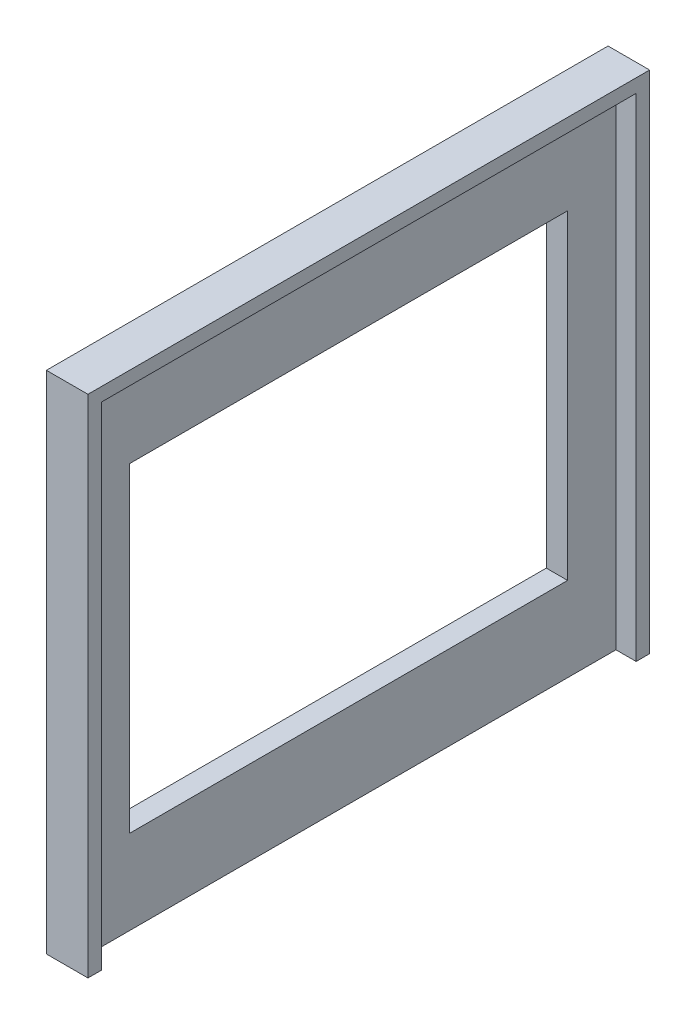
from build123d import *

# Parameters (mm, degrees)
SKETCH1_W           = 500
SKETCH1_H           = 450
SKETCH1_W_2         = 390
SKETCH1_H_2         = 285
BOSS_EXTRUDE1_DEPTH = 19
SKETCH2_W           = 12
SKETCH2_H           = 438
BOSS_EXTRUDE4_DEPTH = 18
SKETCH3_W           = 500
SKETCH3_H           = 12
BOSS_EXTRUDE5_DEPTH = 18
SKETCH4_W           = 12
SKETCH4_H           = 438
BOSS_EXTRUDE6_DEPTH = 18


with BuildPart() as part:
    # Sketch1 → Boss-Extrude1 (new body)
    with BuildSketch(Plane(origin=(0, 0, 0), x_dir=(0, 0, -1), z_dir=(1, 0, 0))):
        with Locations((250, 225)):
            Rectangle(SKETCH1_W, SKETCH1_H)
        with Locations((250, 217.5)):
            Rectangle(SKETCH1_W_2, SKETCH1_H_2, mode=Mode.SUBTRACT)
    extrude(amount=BOSS_EXTRUDE1_DEPTH)

    # Sketch2 → Boss-Extrude4 (add)
    with BuildSketch(Plane(origin=(19, 0, 0), x_dir=(0, 0, -1), z_dir=(1, 0, 0))):
        with Locations((6, 219)):
            Rectangle(SKETCH2_W, SKETCH2_H)
    extrude(amount=BOSS_EXTRUDE4_DEPTH)

    # Sketch3 → Boss-Extrude5 (add)
    with BuildSketch(Plane(origin=(19, 0, 0), x_dir=(0, 0, -1), z_dir=(1, 0, 0))):
        with Locations((250, 444)):
            Rectangle(SKETCH3_W, SKETCH3_H)
    extrude(amount=BOSS_EXTRUDE5_DEPTH)

    # Sketch4 → Boss-Extrude6 (add)
    with BuildSketch(Plane(origin=(19, 0, 0), x_dir=(0, 0, -1), z_dir=(1, 0, 0))):
        with Locations((494, 219)):
            Rectangle(SKETCH4_W, SKETCH4_H)
    extrude(amount=BOSS_EXTRUDE6_DEPTH)


solid = part.part
